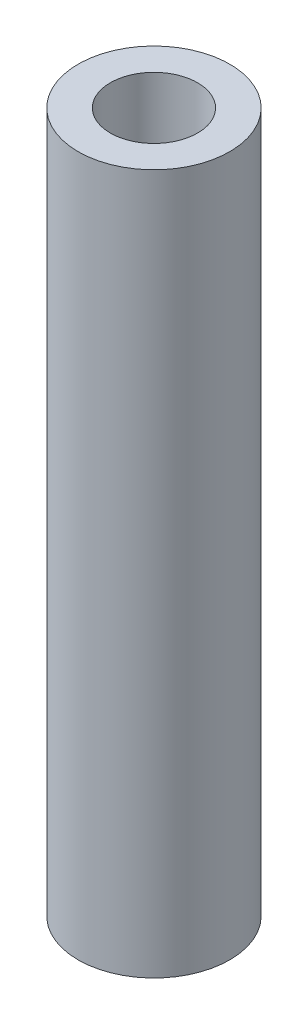
from build123d import *

# Parameters (mm, degrees)
BOSS_EXTRUDE1_DEPTH      = 26.080973
BOSS_EXTRUDE1_DEPTH_BACK = 26.080973
SKETCH1_R                = 5.65
SKETCH1_R_2              = 3.25


with BuildPart() as part:
    # Sketch1 → Boss-Extrude1 (new, two sides: drawn at the far end of the back side and taken through both)
    with BuildSketch(Plane(origin=(0, 0, 0), x_dir=(1, 0, 0), z_dir=(0, 1, 0)).offset(-BOSS_EXTRUDE1_DEPTH_BACK)):
        with Locations(Location((0, 0, 0), (0, 0, 270))):
            Circle(SKETCH1_R)
        with Locations(Location((0, 0, 0), (0, 0, 270))):
            Circle(SKETCH1_R_2, mode=Mode.SUBTRACT)
    extrude(amount=BOSS_EXTRUDE1_DEPTH + BOSS_EXTRUDE1_DEPTH_BACK)


solid = part.part
